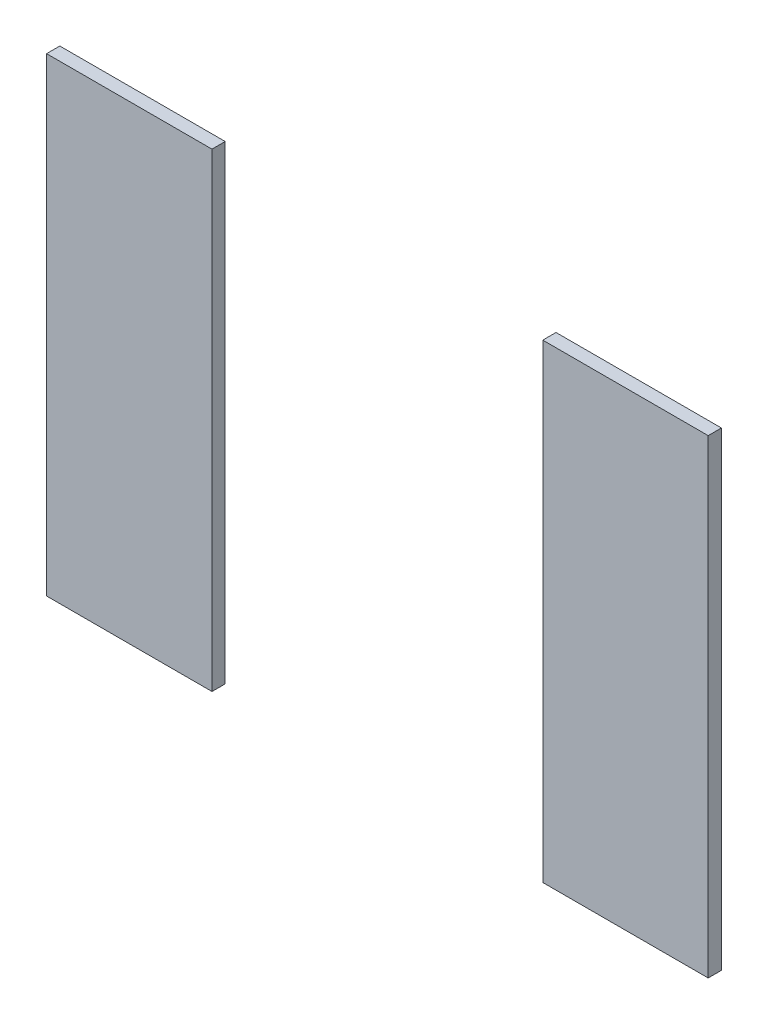
from build123d import *

# Parameters (mm, degrees)
SKETCH2_W             = 250
SKETCH2_H             = 710
BOSS_EXTRUDE1_DEPTH   = 10
BOSS_EXTRUDE1_2_DEPTH = 10


with BuildPart() as part:
    # Sketch2 → Boss-Extrude1 (new, symmetric)
    with BuildSketch(Plane.XY):
        with Locations((-375, -355)):
            Rectangle(SKETCH2_W, SKETCH2_H)
    extrude(amount=BOSS_EXTRUDE1_DEPTH, both=True)


with BuildPart() as body_2:
    # Sketch2 → Boss-Extrude1 2 (new, symmetric)
    with BuildSketch(Plane.XY):
        with Locations((375, -355)):
            Rectangle(SKETCH2_W, SKETCH2_H)
    extrude(amount=BOSS_EXTRUDE1_2_DEPTH, both=True)


solid = Compound([part.part, body_2.part])
